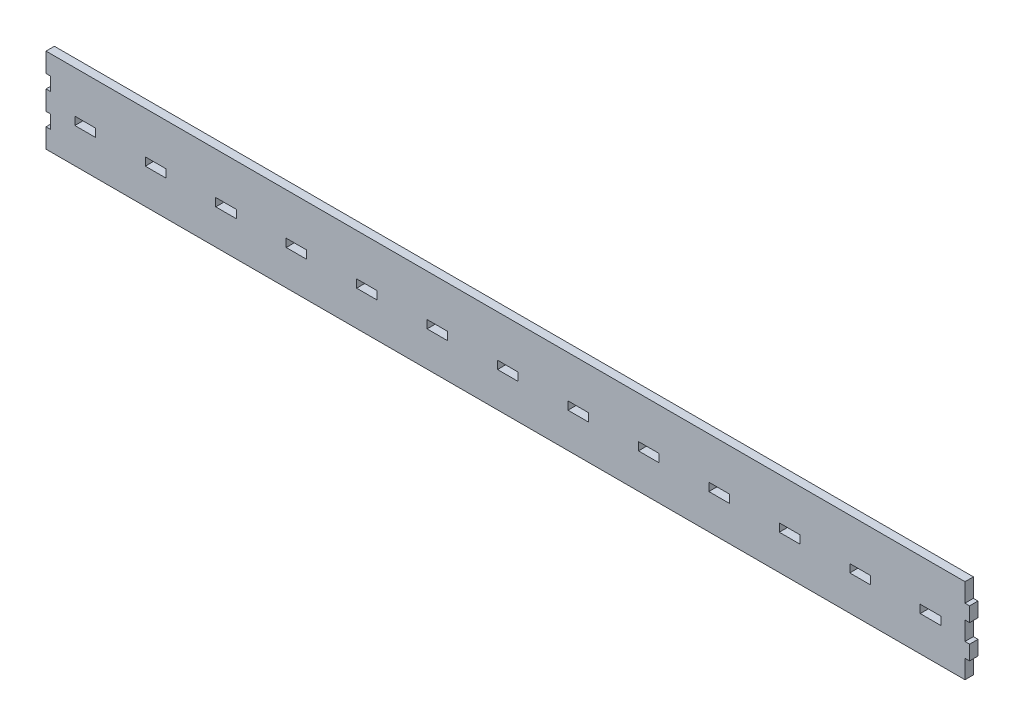
from build123d import *

# Parameters (mm, degrees)
SKETCH_1_W      = 14.7
SKETCH_1_H      = 5.8
EXTRUDE_1_DEPTH = 6


with BuildPart() as part:
    # Эскиз1 → Бобышка-Вытянуть1 (new body)
    with BuildSketch(Plane.XY):
        Polygon((-327.15, -30.4), (327.15, -30.4), (327.15, -17.066666667), (330.45862, -17.066666667), (330.45862, -6.666666667), (327.15, -6.666666667), (327.15, 6.666666667), (330.45862, 6.666666667), (330.45862, 17.066666667), (327.15, 17.066666667), (327.15, 30.4), (-327.15, 30.4), (-330.45862, 30.4), (-330.45862, 16.533333333), (-327.15, 16.533333333), (-327.15, 6.933333333), (-330.45862, 6.933333333), (-330.45862, -6.933333333), (-327.15, -6.933333333), (-327.15, -16.533333333), (-330.45862, -16.533333333), (-330.45862, -30.4), align=None)
        with Locations((-252.05, -2.5)):
            Rectangle(SKETCH_1_W, SKETCH_1_H, mode=Mode.SUBTRACT)
        with Locations((-302.46, -2.5)):
            Rectangle(SKETCH_1_W, SKETCH_1_H, mode=Mode.SUBTRACT)
        with Locations((-201.64, -2.5)):
            Rectangle(SKETCH_1_W, SKETCH_1_H, mode=Mode.SUBTRACT)
        with Locations((-151.23, -2.5)):
            Rectangle(SKETCH_1_W, SKETCH_1_H, mode=Mode.SUBTRACT)
        with Locations((-100.82, -2.5)):
            Rectangle(SKETCH_1_W, SKETCH_1_H, mode=Mode.SUBTRACT)
        with Locations((-50.41, -2.5)):
            Rectangle(SKETCH_1_W, SKETCH_1_H, mode=Mode.SUBTRACT)
        with Locations((0, -2.5)):
            Rectangle(SKETCH_1_W, SKETCH_1_H, mode=Mode.SUBTRACT)
        with Locations((50.41, -2.5)):
            Rectangle(SKETCH_1_W, SKETCH_1_H, mode=Mode.SUBTRACT)
        with Locations((100.82, -2.5)):
            Rectangle(SKETCH_1_W, SKETCH_1_H, mode=Mode.SUBTRACT)
        with Locations((151.23, -2.5)):
            Rectangle(SKETCH_1_W, SKETCH_1_H, mode=Mode.SUBTRACT)
        with Locations((201.64, -2.5)):
            Rectangle(SKETCH_1_W, SKETCH_1_H, mode=Mode.SUBTRACT)
        with Locations((252.05, -2.5)):
            Rectangle(SKETCH_1_W, SKETCH_1_H, mode=Mode.SUBTRACT)
        with Locations((302.46, -2.5)):
            Rectangle(SKETCH_1_W, SKETCH_1_H, mode=Mode.SUBTRACT)
    extrude(amount=EXTRUDE_1_DEPTH)


solid = part.part
